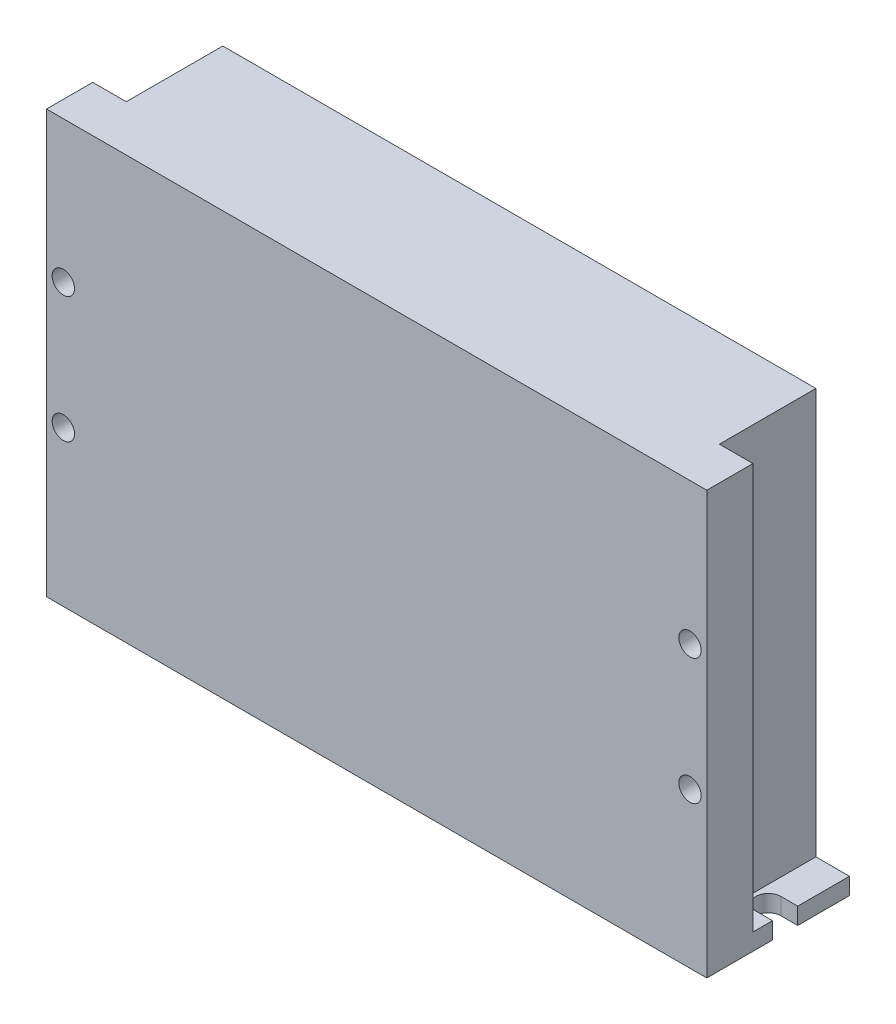
from build123d import *

# Parameters (mm, degrees)
SKETCH_1_W          = 118
SKETCH_1_H          = 25.5
EXTRUDE_1_DEPTH     = 75.5
SKETCH_2_W          = 6
SKETCH_2_H          = 17.25
CUT_EXTRUDE_1_DEPTH = 72.5
CUT_EXTRUDE_2_DEPTH = 141.820808122
SKETCH_4_R          = 2
CUT_EXTRUDE_3_DEPTH = 142.144650979


with BuildPart() as part:
    # 草图1 → 凸台-拉伸1 (new body)
    with BuildSketch(Plane(origin=(0, 0, 0), x_dir=(1, 0, 0), z_dir=(0, 1, 0))):
        with Locations((59, -12.75)):
            Rectangle(SKETCH_1_W, SKETCH_1_H)
    extrude(amount=EXTRUDE_1_DEPTH)

    # 草图2 → 切除-拉伸1 (cut)
    with BuildSketch(Plane(origin=(0, 75.5, 0), x_dir=(1, 0, 0), z_dir=(0, 1, 0))):
        with Locations((3, -8.625)):
            Rectangle(SKETCH_2_W, SKETCH_2_H)
        with Locations((115, -8.625)):
            Rectangle(SKETCH_2_W, SKETCH_2_H)
    extrude(amount=-CUT_EXTRUDE_1_DEPTH, mode=Mode.SUBTRACT)

    # 草图3 → 切除-拉伸2 (cut, through all)
    with BuildSketch(Plane(origin=(0, 3, 0), x_dir=(1, 0, 0), z_dir=(0, 1, 0))):
        with BuildLine():
            Line((0, -13.75), (3, -13.75))
            ThreePointArc((3, -13.75), (5.25, -11.5), (3, -9.25))
            Line((3, -9.25), (0, -9.25))
            Line((0, -9.25), (0, -13.75))
        make_face()
        with BuildLine():
            Line((118, -13.75), (118, -9.25))
            Line((118, -9.25), (115, -9.25))
            ThreePointArc((115, -9.25), (112.75, -11.5), (115, -13.75))
            Line((115, -13.75), (118, -13.75))
        make_face()
    extrude(amount=-CUT_EXTRUDE_2_DEPTH, mode=Mode.SUBTRACT)

    # 草图4 → 切除-拉伸3 (cut, through all)
    with BuildSketch(Plane(origin=(0, 0, 17.25), x_dir=(-1, 0, 0), z_dir=(0, 0, -1))):
        with Locations((-115, 50.2)):
            Circle(SKETCH_4_R)
        with Locations((-115, 27.7)):
            Circle(SKETCH_4_R)
        with Locations((-3, 50.2)):
            Circle(SKETCH_4_R)
        with Locations((-3, 27.7)):
            Circle(SKETCH_4_R)
    extrude(amount=-CUT_EXTRUDE_3_DEPTH, mode=Mode.SUBTRACT)


solid = part.part
